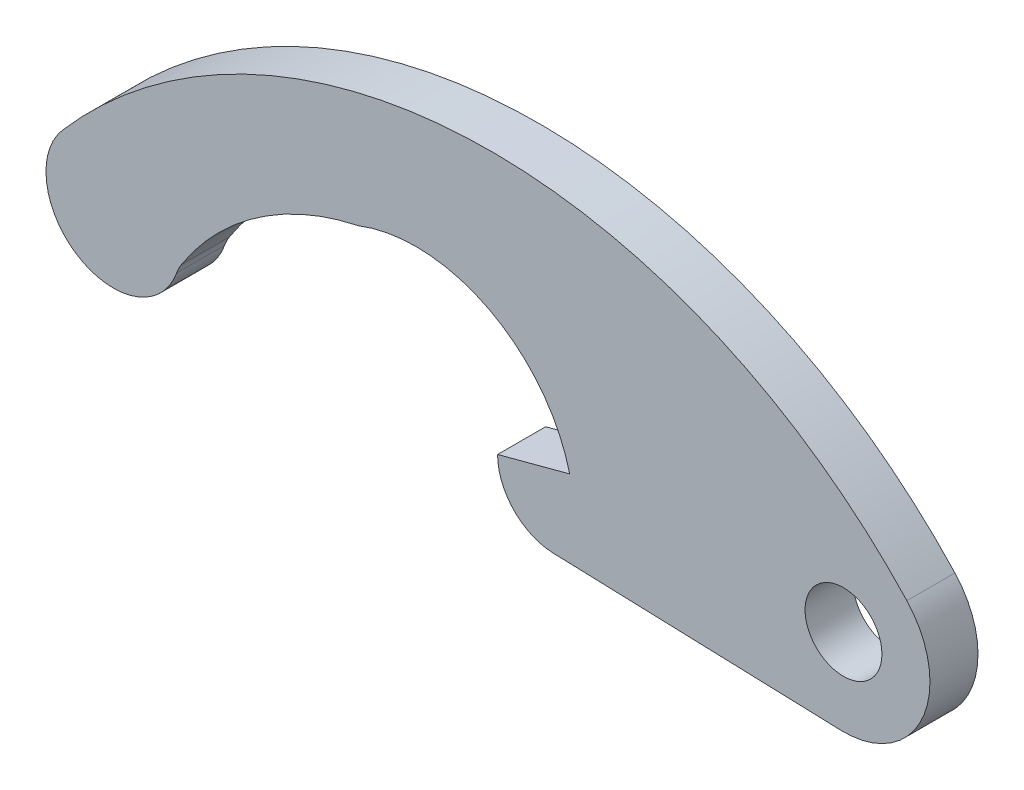
from build123d import *

# Parameters (mm, degrees)
BOSS_EXTRUDE1_DEPTH = 2.54
SKETCH2_R           = 2.032
CUT_EXTRUDE1_DEPTH  = 61.316926471


with BuildPart() as part:
    # Sketch1 → Boss-Extrude1 (new body)
    with BuildSketch(Plane.XY):
        with BuildLine():
            Line((-18.135713172, 23.369697581), (-2.946569758, 22.862546371))
            ThreePointArc((-2.946569758, 22.862546371), (1.365281203, 25.533694473), (0.557997895, 30.541227253))
            ThreePointArc((0.557997895, 30.541227253), (-21.942363625, 40.125896641), (-44.092394737, 29.757276792))
            ThreePointArc((-44.092394737, 29.757276792), (-43.193963557, 24.360517848), (-38.053791843, 26.234236193))
            ThreePointArc((-38.053791843, 26.234236193), (-37.941623484, 26.499357867), (-37.800175961, 26.750084494))
            ThreePointArc((-37.800175961, 26.750084494), (-33.769573387, 30.919616017), (-28.44204105, 33.2105))
            ThreePointArc((-28.44204105, 33.2105), (-21.549726751, 32.845355593), (-17.268032218, 27.432))
            Line((-17.268032218, 27.432), (-21.082, 26.416))
            ThreePointArc((-21.082, 26.416), (-20.2249274, 24.29700469), (-18.135713172, 23.369697581))
        make_face()
    extrude(amount=BOSS_EXTRUDE1_DEPTH)

    # Sketch2 → Cut-Extrude1 (cut, through all)
    with BuildSketch(Plane.XY.offset(2.54)):
        with Locations((-2.794, 27.432)):
            Circle(SKETCH2_R)
    extrude(amount=-CUT_EXTRUDE1_DEPTH, mode=Mode.SUBTRACT)


solid = part.part
